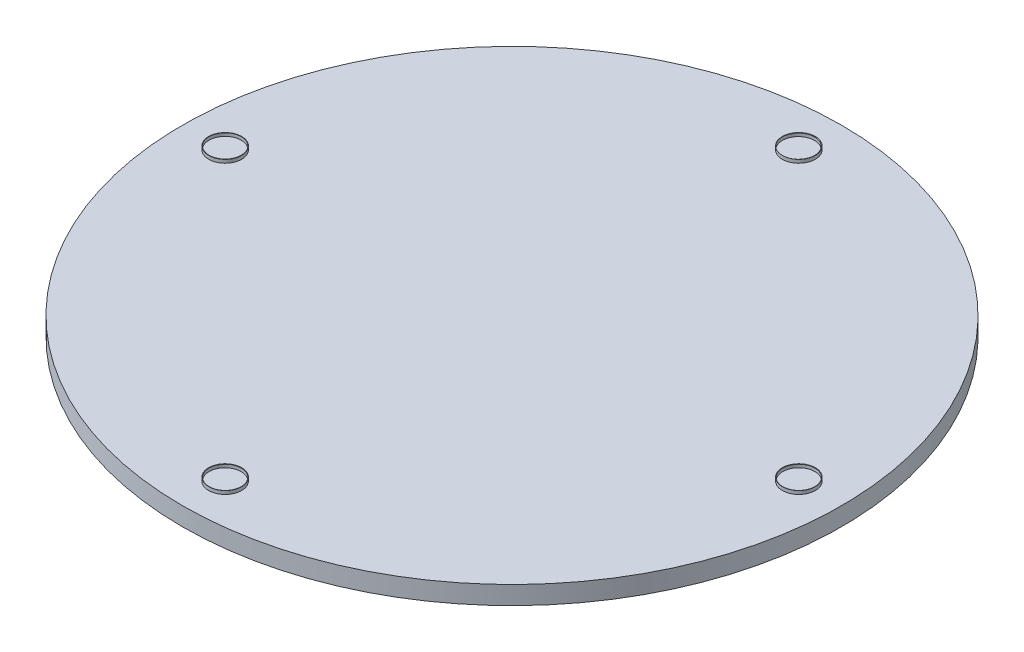
from build123d import *

# Parameters (mm, degrees)
SKETCH1_R           = 540
BOSS_EXTRUDE1_DEPTH = 30
SKETCH7_R           = 27
BOSS_EXTRUDE2_DEPTH = 5.5
SKETCH10_R          = 26.3
CUT_EXTRUDE1_DEPTH  = 5
SKETCH11_R          = 27
BOSS_EXTRUDE3_DEPTH = 5.5
SKETCH12_R          = 26.3
CUT_EXTRUDE2_DEPTH  = 5
SKETCH13_R          = 26.3
CUT_EXTRUDE3_DEPTH  = 5
SKETCH14_R          = 26.3
CUT_EXTRUDE4_DEPTH  = 5


with BuildPart() as part:
    # Sketch1 → Boss-Extrude1 (new body)
    with BuildSketch(Plane(origin=(0, 0, 0), x_dir=(1, 0, 0), z_dir=(0, 1, 0))):
        with Locations(Location((0, 0, 0), (0, 0, 270))):
            Circle(SKETCH1_R)
    extrude(amount=BOSS_EXTRUDE1_DEPTH)

    # Sketch7 → Boss-Extrude2 (add)
    with BuildSketch(Plane(origin=(0, 30, 0), x_dir=(1, 0, 0), z_dir=(0, 1, 0))):
        with Locations(Location((-470, 0, 0), (0, 0, 270))):
            Circle(SKETCH7_R)
    boss_extrude2 = extrude(amount=BOSS_EXTRUDE2_DEPTH)

    # Sketch10 → Cut-Extrude1 (cut)
    with BuildSketch(Plane(origin=(0, 35.5, 0), x_dir=(1, 0, 0), z_dir=(0, 1, 0))):
        with Locations(Location((-470, 0, 0), (0, 0, 270))):
            Circle(SKETCH10_R)
    extrude(amount=-CUT_EXTRUDE1_DEPTH, mode=Mode.SUBTRACT)

    # Mirror1: Boss-Extrude2 across plane
    add(boss_extrude2.mirror(Plane(origin=(0, 0, 0), x_dir=(0, 0, 1), z_dir=(1, 0, 0))))

    # Sketch11 → Boss-Extrude3 (add)
    with BuildSketch(Plane(origin=(0, 30, 0), x_dir=(1, 0, 0), z_dir=(0, 1, 0))):
        with Locations(Location((0, 470, 0), (0, 0, 270))):
            Circle(SKETCH11_R)
    boss_extrude3 = extrude(amount=BOSS_EXTRUDE3_DEPTH)

    # Sketch12 → Cut-Extrude2 (cut)
    with BuildSketch(Plane(origin=(0, 35.5, 0), x_dir=(1, 0, 0), z_dir=(0, 1, 0))):
        with Locations(Location((0, 469.354248554, 0), (0, 0, 270))):
            Circle(SKETCH12_R)
    extrude(amount=-CUT_EXTRUDE2_DEPTH, mode=Mode.SUBTRACT)

    # Mirror2: Boss-Extrude3 across plane
    add(boss_extrude3.mirror(Plane.XY))

    # Sketch13 → Cut-Extrude3 (cut)
    with BuildSketch(Plane(origin=(0, 35.5, 0), x_dir=(1, 0, 0), z_dir=(0, 1, 0))):
        with Locations(Location((0.231268316, -470.275017284, 0), (0, 0, 270))):
            Circle(SKETCH13_R)
    extrude(amount=-CUT_EXTRUDE3_DEPTH, mode=Mode.SUBTRACT)

    # Sketch14 → Cut-Extrude4 (cut)
    with BuildSketch(Plane(origin=(0, 35.5, 0), x_dir=(1, 0, 0), z_dir=(0, 1, 0))):
        with Locations(Location((470.23112187, -0.273591473, 0), (0, 0, 270))):
            Circle(SKETCH14_R)
    extrude(amount=-CUT_EXTRUDE4_DEPTH, mode=Mode.SUBTRACT)


solid = part.part
